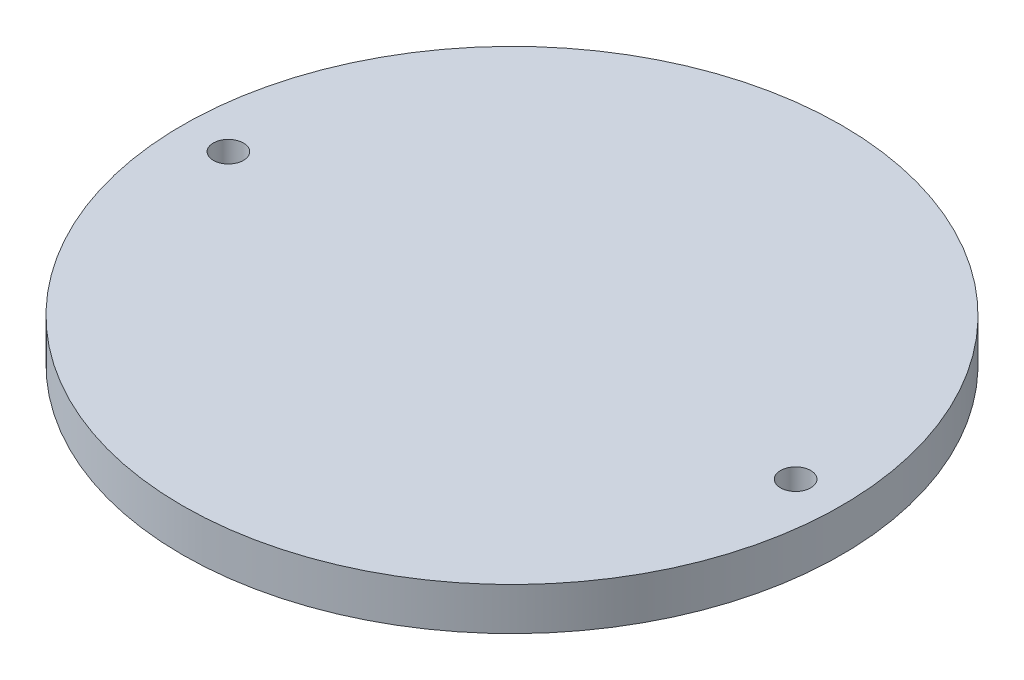
from build123d import *

# Parameters (mm, degrees)
SKETCH1_R           = 73.787
BOSS_EXTRUDE1_DEPTH = 9.525
SKETCH2_R           = 3.3782
CUT_EXTRUDE1_DEPTH  = 105.784389882


with BuildPart() as part:
    # Sketch1 → Boss-Extrude1 (new body)
    with BuildSketch(Plane(origin=(0, 0, 0), x_dir=(1, 0, 0), z_dir=(0, 1, 0))):
        with Locations(Location((0, 0, 0), (0, 0, 90))):
            Circle(SKETCH1_R)
    extrude(amount=BOSS_EXTRUDE1_DEPTH)

    # Sketch2 → Cut-Extrude1 (cut, through all)
    with BuildSketch(Plane(origin=(0, 9.525, 0), x_dir=(1, 0, 0), z_dir=(0, 1, 0))):
        with Locations(Location((-63.5, 0, 0), (0, 0, 270))):
            Circle(SKETCH2_R)
        with Locations(Location((63.5, 0, 0), (0, 0, 270))):
            Circle(SKETCH2_R)
    extrude(amount=-CUT_EXTRUDE1_DEPTH, mode=Mode.SUBTRACT)


solid = part.part
